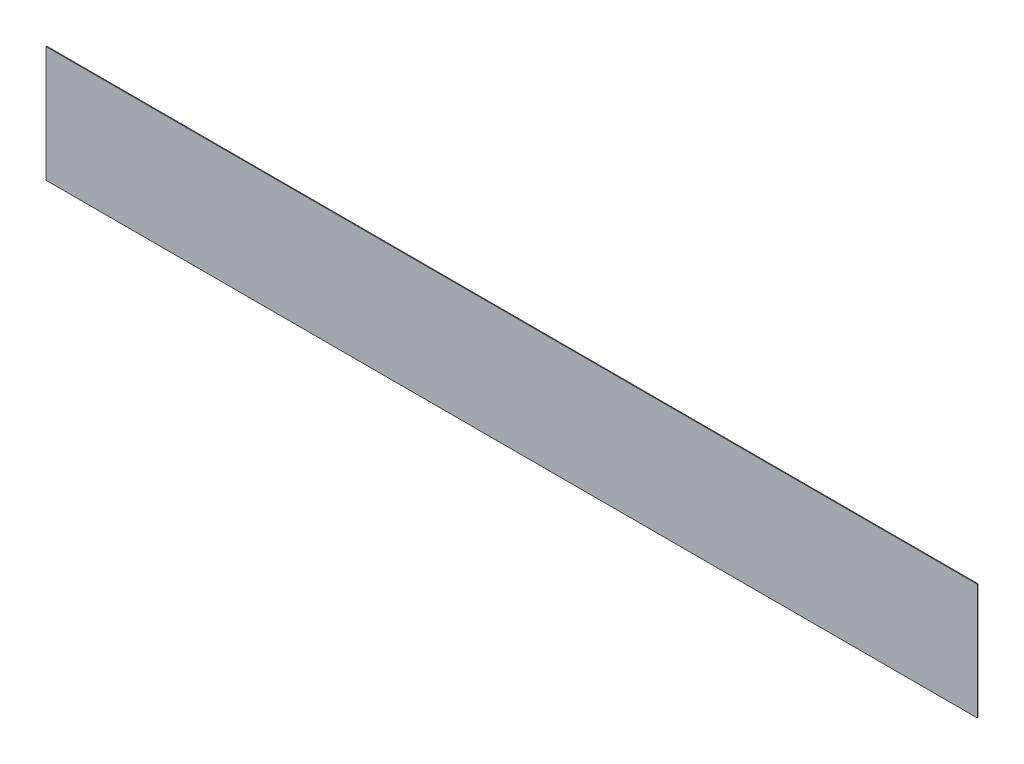
from build123d import *

# Parameters (mm, degrees)
SKETCH1_W           = 2500
SKETCH1_H           = 311
BOSS_EXTRUDE1_DEPTH = 2


with BuildPart() as part:
    # Sketch1 → Boss-Extrude1 (new body)
    with BuildSketch(Plane.XY):
        with Locations((1250, 155.5)):
            Rectangle(SKETCH1_W, SKETCH1_H)
    extrude(amount=BOSS_EXTRUDE1_DEPTH)


solid = part.part
